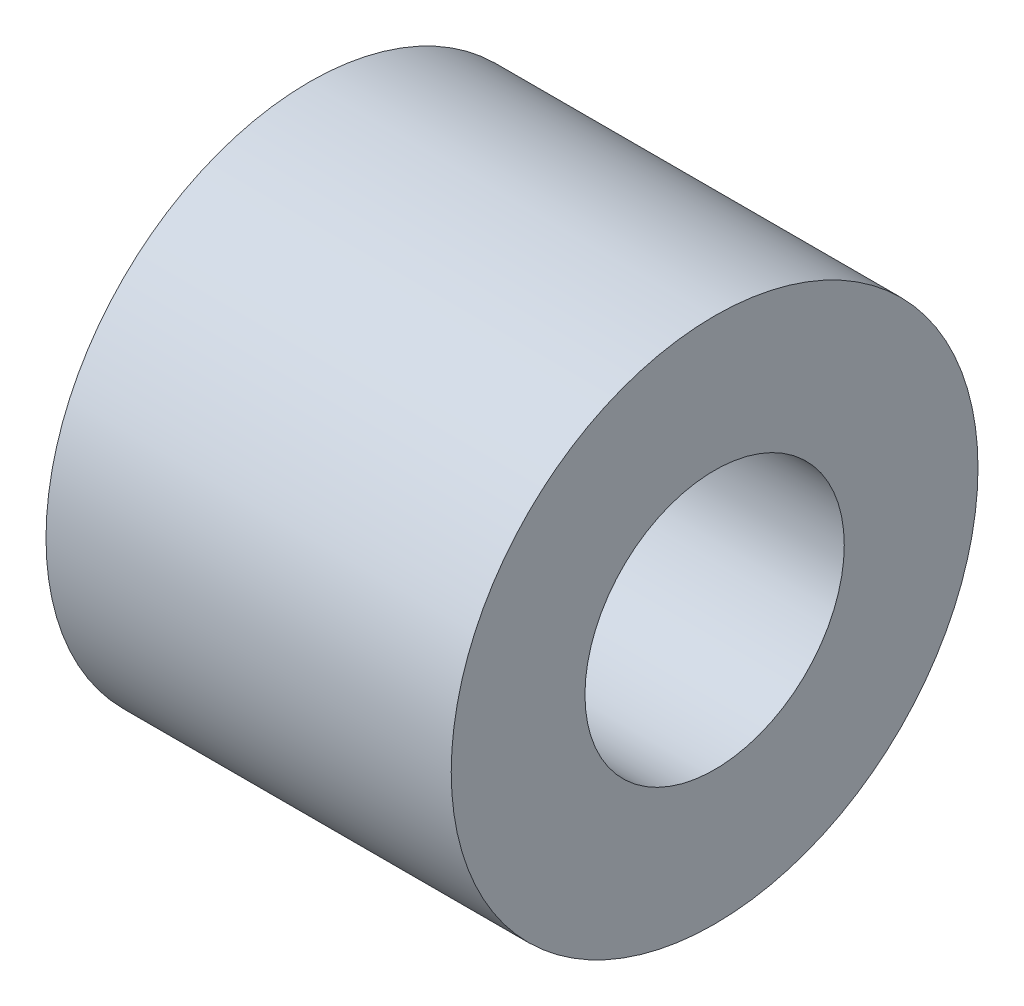
from build123d import *

# Parameters (mm, degrees)
SKETCH1_R           = 6.5
SKETCH1_R_2         = 3.2
BOSS_EXTRUDE1_DEPTH = 10


with BuildPart() as part:
    # Sketch1 → Boss-Extrude1 (new body)
    with BuildSketch(Plane(origin=(0, 0, 0), x_dir=(0, 0, -1), z_dir=(1, 0, 0))):
        Circle(SKETCH1_R)
        Circle(SKETCH1_R_2, mode=Mode.SUBTRACT)
    extrude(amount=BOSS_EXTRUDE1_DEPTH)


solid = part.part
